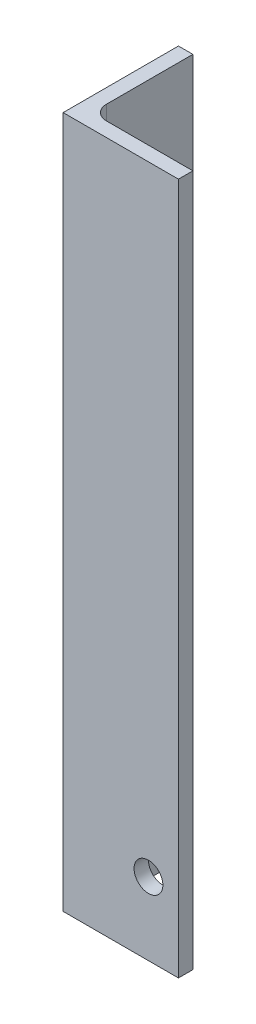
from build123d import *

# Parameters (mm, degrees)
BOSS_EXTRUDE1_DEPTH = 152.4
FILLET2_R           = 3.175
SKETCH3_R           = 3.175
CUT_EXTRUDE2_DEPTH  = 157.576115675
CUT_EXTRUDE3_REACH  = 158.576
SKETCH4_R           = 3.175


with BuildPart() as part:
    # Sketch1 → Boss-Extrude1 (new body)
    with BuildSketch(Plane(origin=(0, 0, 0), x_dir=(1, 0, 0), z_dir=(0, 1, 0))):
        Polygon((0, 0), (0, -25.4), (25.4, -25.4), (25.4, -22.225), (3.175, -22.225), (3.175, 0), align=None)
    extrude(amount=BOSS_EXTRUDE1_DEPTH)

    # Fillet2
    fillet2_edges = [part.edges().sort_by_distance(p)[0] for p in [
        (3.175, 76.2, 22.225),
    ]]
    fillet(fillet2_edges, radius=FILLET2_R)

    # Sketch3 → Cut-Extrude2 (cut, through all)
    with BuildSketch(Plane.ZY):
        with Locations((6.604, 15.875)):
            Circle(SKETCH3_R)
    extrude(amount=-CUT_EXTRUDE2_DEPTH, mode=Mode.SUBTRACT)

    # Sketch4 → Cut-Extrude3 (cut, up to next)
    with BuildSketch(Plane.XY.offset(25.4), mode=Mode.PRIVATE) as cut_extrude3_sk1:
        with Locations((18.796, 16.002)):
            Circle(SKETCH4_R)
    cut_extrude3_tool1 = extrude(cut_extrude3_sk1.sketch, amount=-CUT_EXTRUDE3_REACH, mode=Mode.PRIVATE) & part.part
    add(cut_extrude3_tool1.solids().sort_by_distance((18.796, 16.002, 25.4))[0], mode=Mode.SUBTRACT)


solid = part.part
